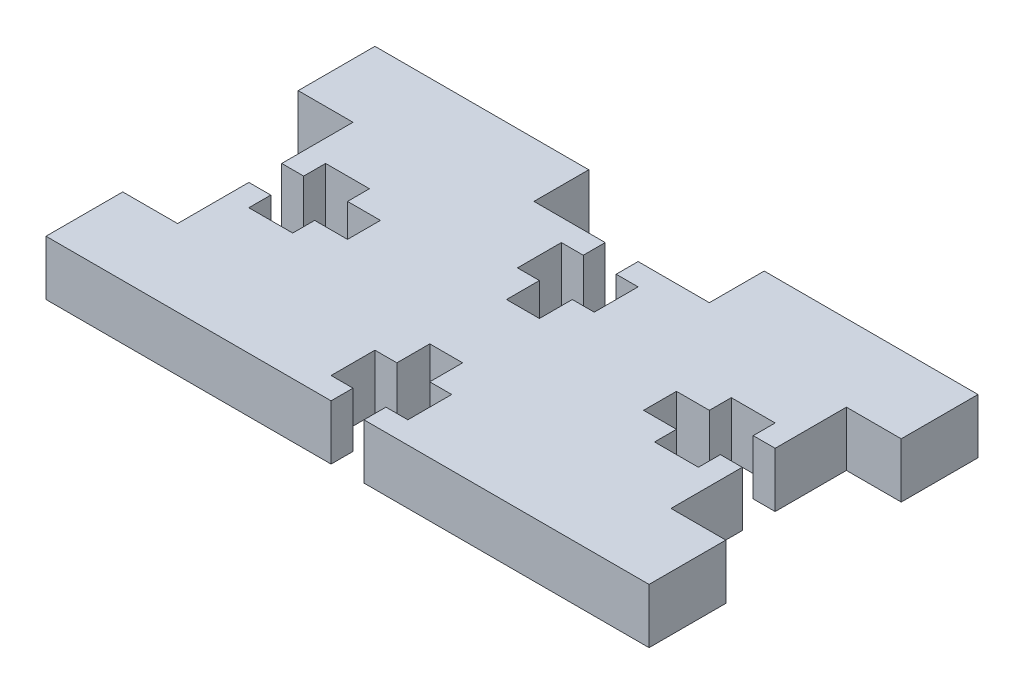
from build123d import *

# Parameters (mm, degrees)
CROQUIS1_W              = 55
CROQUIS1_H              = 30
SALIENTE_EXTRUIR1_DEPTH = 5
CORTAR_EXTRUIR1_DEPTH   = 32.721443851
CORTAR_EXTRUIR2_DEPTH   = 32.721443851
CORTAR_EXTRUIR3_DEPTH   = 32.721443851


with BuildPart() as part:
    # Croquis1 → Saliente-Extruir1 (new body)
    with BuildSketch(Plane(origin=(0, 0, 0), x_dir=(1, 0, 0), z_dir=(0, 1, 0))):
        Rectangle(CROQUIS1_W, CROQUIS1_H)
    extrude(amount=SALIENTE_EXTRUIR1_DEPTH)

    # Croquis2 → Cortar-Extruir1 (cut, through all)
    with BuildSketch(Plane(origin=(0, 5, 0), x_dir=(1, 0, 0), z_dir=(0, 1, 0))):
        Polygon((-22.5, 8), (-27.5, 8), (-27.5, -8), (-22.5, -8), (-22.5, -1.5), (-20.5, -1.5), (-20.5, -3.5), (-16.5, -3.5), (-16.5, -1.5), (-13.5, -1.5), (-13.5, 1.5), (-16.5, 1.5), (-16.5, 3.5), (-20.5, 3.5), (-20.5, 1.5), (-22.5, 1.5), align=None)
    cortar_extruir1 = extrude(amount=-CORTAR_EXTRUIR1_DEPTH, mode=Mode.SUBTRACT)

    # Simetría1: Cortar-Extruir1 across plane
    add(cortar_extruir1.mirror(Plane(origin=(0, 0, 0), x_dir=(0, 0, 1), z_dir=(1, 0, 0))), mode=Mode.SUBTRACT)

    # Croquis3 → Cortar-Extruir2 (cut, through all)
    with BuildSketch(Plane(origin=(0, 5, 0), x_dir=(1, 0, 0), z_dir=(0, 1, 0))):
        Polygon((-8, 15), (8, 15), (8, 10), (1.5, 10), (1.5, 8), (3.5, 8), (3.5, 4), (1.5, 4), (1.5, 1), (-1.5, 1), (-1.5, 4), (-3.5, 4), (-3.5, 8), (-1.5, 8), (-1.5, 10), (-8, 10), align=None)
    extrude(amount=-CORTAR_EXTRUIR2_DEPTH, mode=Mode.SUBTRACT)

    # Croquis4 → Cortar-Extruir3 (cut, through all)
    with BuildSketch(Plane(origin=(0, 5, 0), x_dir=(1, 0, 0), z_dir=(0, 1, 0))):
        Polygon((1.5, -15), (1.5, -13), (3.5, -13), (3.5, -9), (1.5, -9), (1.5, -6), (-1.5, -6), (-1.5, -9), (-3.5, -9), (-3.5, -13), (-1.5, -13), (-1.5, -15), align=None)
    extrude(amount=-CORTAR_EXTRUIR3_DEPTH, mode=Mode.SUBTRACT)


solid = part.part
